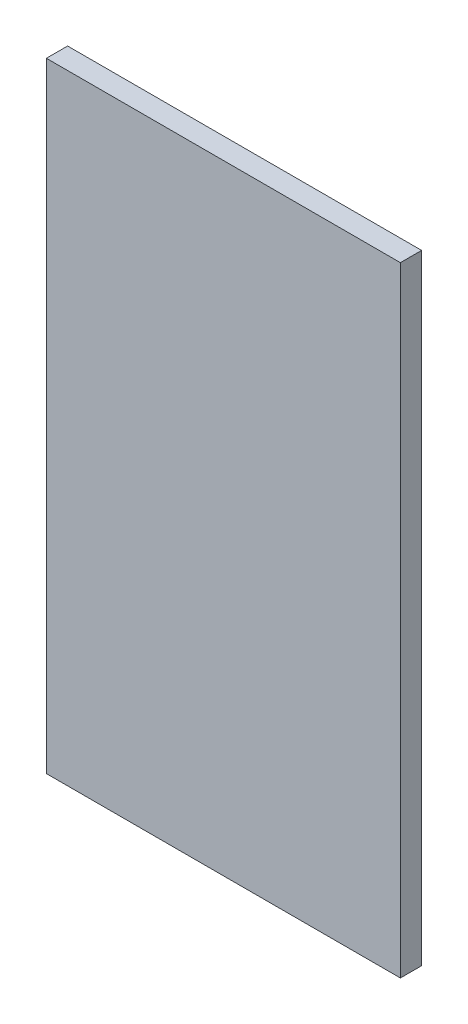
from build123d import *

# Parameters (mm, degrees)
SKETCH1_W           = 100
SKETCH1_H           = 175
BOSS_EXTRUDE1_DEPTH = 6


with BuildPart() as part:
    # Sketch1 → Boss-Extrude1 (new body)
    with BuildSketch(Plane.XY):
        Rectangle(SKETCH1_W, SKETCH1_H)
    extrude(amount=BOSS_EXTRUDE1_DEPTH)


solid = part.part
